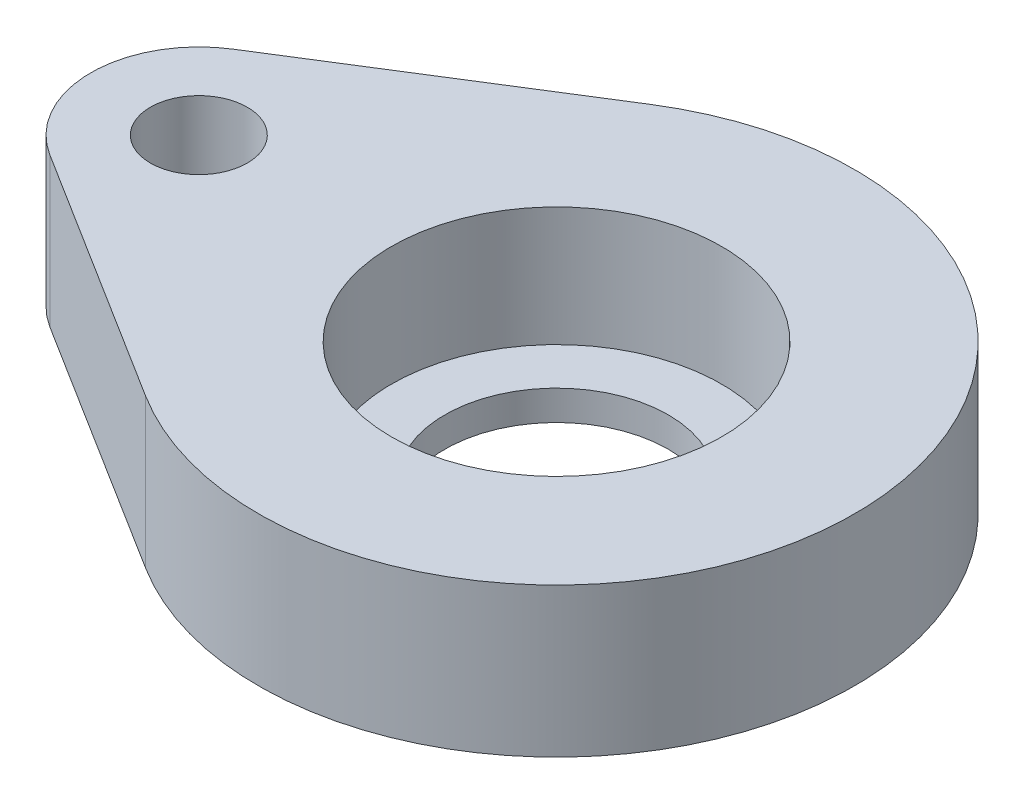
from build123d import *

# Parameters (mm, degrees)
AUFSATZ_LINEAR_AUSTRAGEN1_DEPTH = 10
SKIZZE2_R                       = 3.25
SKIZZE2_R_2                     = 11.075
SCHNITT_LINEAR_AUSTRAGEN1_DEPTH = 8
SKIZZE3_R                       = 7.5
SKIZZE3_R_2                     = 1.5
SCHNITT_LINEAR_AUSTRAGEN2_DEPTH = 2


with BuildPart() as part:
    # Skizze1 → Aufsatz-Linear austragen1 (new body)
    with BuildSketch(Plane(origin=(0, 0, 0), x_dir=(1, 0, 0), z_dir=(0, 1, 0))):
        with BuildLine():
            Line((-3.8515625, -6.142309526), (13.375, -16.94430214))
            ThreePointArc((13.375, -16.94430214), (44, 0), (13.375, 16.94430214))
            Line((13.375, 16.94430214), (-3.8515625, 6.142309526))
            ThreePointArc((-3.8515625, 6.142309526), (-7.25, 0), (-3.8515625, -6.142309526))
        make_face()
    extrude(amount=AUFSATZ_LINEAR_AUSTRAGEN1_DEPTH)

    # Skizze2 → Schnitt-Linear austragen1 (cut)
    with BuildSketch(Plane(origin=(0, 10, 0), x_dir=(1, 0, 0), z_dir=(0, 1, 0))):
        with Locations(Location((0, 0, 0), (0, 0, 270))):
            Circle(SKIZZE2_R)
        with Locations(Location((24, 0, 0), (0, 0, 270))):
            Circle(SKIZZE2_R_2)
    extrude(amount=-SCHNITT_LINEAR_AUSTRAGEN1_DEPTH, mode=Mode.SUBTRACT)

    # Skizze3 → Schnitt-Linear austragen2 (cut)
    with BuildSketch(Plane(origin=(0, 2, 0), x_dir=(1, 0, 0), z_dir=(0, 1, 0))):
        with Locations(Location((24, 0, 0), (0, 0, 270))):
            Circle(SKIZZE3_R)
        with Locations(Location((0, 0, 0), (0, 0, 270))):
            Circle(SKIZZE3_R_2)
    extrude(amount=-SCHNITT_LINEAR_AUSTRAGEN2_DEPTH, mode=Mode.SUBTRACT)


solid = part.part
